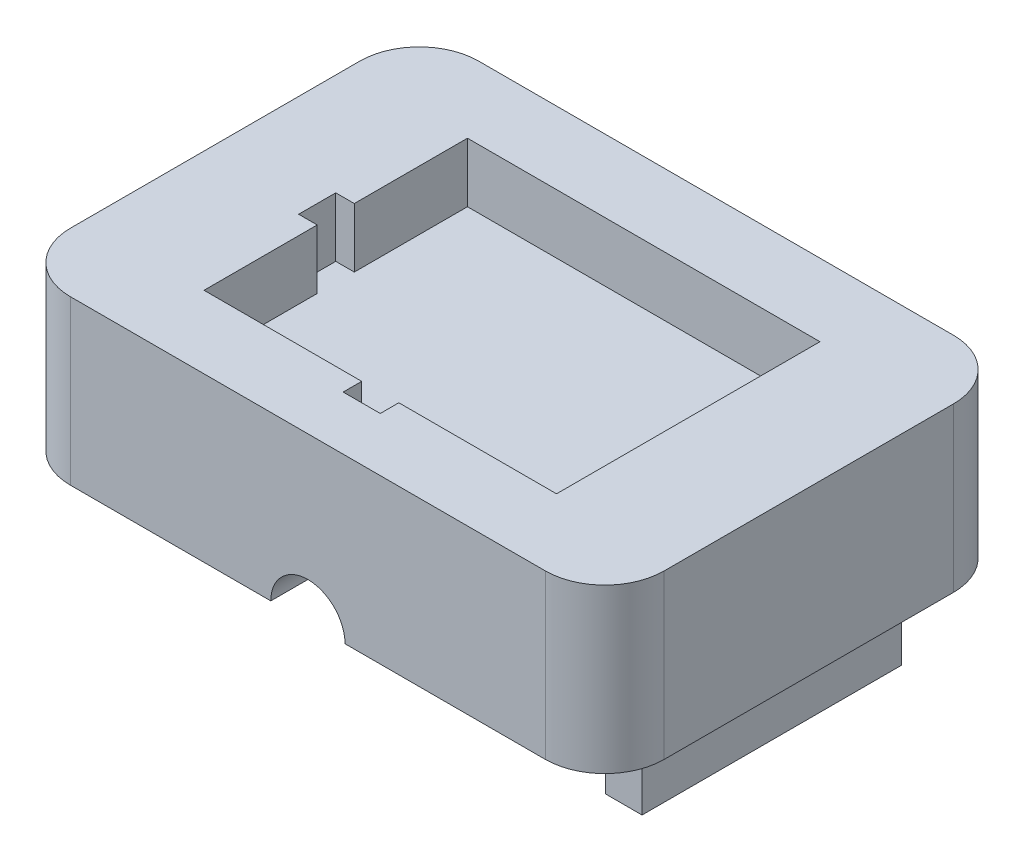
from build123d import *

# Parameters (mm, degrees)
SALIENTE_EXTRUIR1_DEPTH = 55
CROQUIS2_R              = 9.525
CORTAR_EXTRUIR1_DEPTH   = 3.025
CROQUIS3_W              = 4.95
CROQUIS3_H              = 34.95
SALIENTE_EXTRUIR2_DEPTH = 10
REDONDEO1_R             = 8
CORTAR_EXTRUIR2_DEPTH   = 8


with BuildPart() as part:
    # Croquis1 → Saliente-Extruir1 (new body)
    with BuildSketch(Plane.XY):
        with BuildLine():
            Line((-40, 0), (-5, 0))
            ThreePointArc((-5, 0), (0, 5), (5, 0))
            Line((5, 0), (40, 0))
            Line((40, 0), (40, 22))
            Line((40, 22), (-40, 22))
            Line((-40, 22), (-40, 0))
        make_face()
    extrude(amount=SALIENTE_EXTRUIR1_DEPTH)

    # Croquis2 → Cortar-Extruir1 (cut, symmetric)
    with BuildSketch(Plane.XY.offset(27.5)):
        Circle(CROQUIS2_R)
    extrude(amount=CORTAR_EXTRUIR1_DEPTH, both=True, mode=Mode.SUBTRACT)

    # Croquis3 → Saliente-Extruir2 (add)
    with BuildSketch(Plane.XZ):
        with Locations((-32.525, 27.5)):
            Rectangle(CROQUIS3_W, CROQUIS3_H)
        with Locations((32.525, 27.5)):
            Rectangle(CROQUIS3_W, CROQUIS3_H)
    extrude(amount=SALIENTE_EXTRUIR2_DEPTH)

    # Redondeo1
    redondeo1_edges = [part.edges().sort_by_distance(p)[0] for p in [
        (40, 11, 55),
        (-40, 11, 55),
        (-40, 11, 0),
        (40, 11, 0),
    ]]
    fillet(redondeo1_edges, radius=REDONDEO1_R)

    # Croquis6 → Cortar-Extruir2 (cut)
    with BuildSketch(Plane(origin=(0, 22, 0), x_dir=(1, 0, 0), z_dir=(0, 1, 0))):
        Polygon((-23.75, -45.25), (-2.5, -45.25), (-2.5, -47.75), (2.5, -47.75), (2.5, -45.25), (23.75, -45.25), (23.75, -9.75), (-23.75, -9.75), (-23.75, -25), (-26.25, -25), (-26.25, -30), (-23.75, -30), align=None)
    extrude(amount=-CORTAR_EXTRUIR2_DEPTH, mode=Mode.SUBTRACT)


solid = part.part
